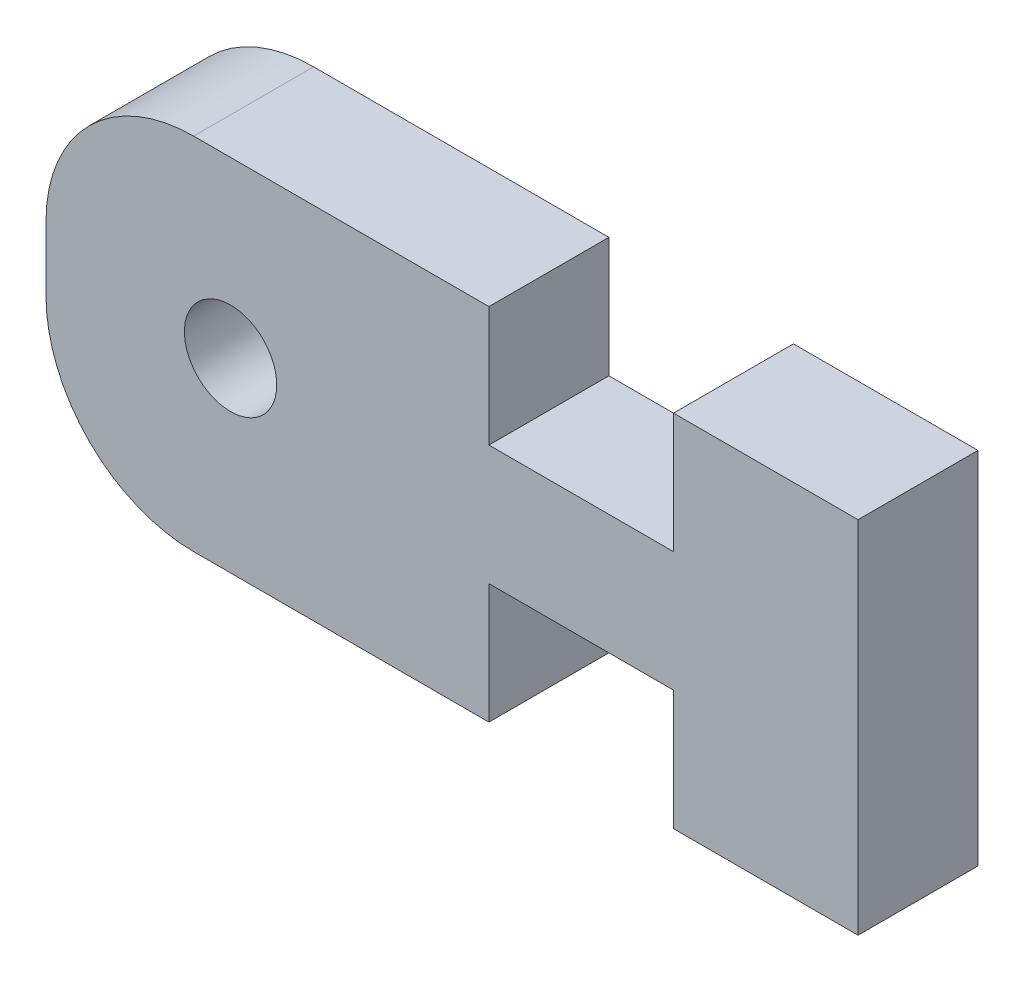
from build123d import *

# Parameters (mm, degrees)
SKETCH1_W           = 44
SKETCH1_H           = 19.5
BOSS_EXTRUDE1_DEPTH = 6.5
CUT_EXTRUDE1_REACH  = 50.564
SKETCH2_W           = 10
SKETCH2_H           = 6.5
FILLET1_R           = 8
CUT_EXTRUDE2_REACH  = 50.564
SKETCH3_R           = 2.5


with BuildPart() as part:
    # Sketch1 → Boss-Extrude1 (new body)
    with BuildSketch(Plane.XY):
        with Locations((22, 9.75)):
            Rectangle(SKETCH1_W, SKETCH1_H)
    extrude(amount=BOSS_EXTRUDE1_DEPTH)

    # Sketch2 → Cut-Extrude1 (cut, up to next)
    with BuildSketch(Plane.XY.offset(6.5), mode=Mode.PRIVATE) as cut_extrude1_sk1:
        with Locations((29, 16.25)):
            Rectangle(SKETCH2_W, SKETCH2_H)
    cut_extrude1_tool1 = extrude(cut_extrude1_sk1.sketch, amount=-CUT_EXTRUDE1_REACH, mode=Mode.PRIVATE) & part.part
    # Sketch2 → Cut-Extrude1 (cut, up to next)
    with BuildSketch(Plane.XY.offset(6.5), mode=Mode.PRIVATE) as cut_extrude1_sk2:
        with Locations((29, 3.25)):
            Rectangle(SKETCH2_W, SKETCH2_H)
    cut_extrude1_tool2 = extrude(cut_extrude1_sk2.sketch, amount=-CUT_EXTRUDE1_REACH, mode=Mode.PRIVATE) & part.part
    add(cut_extrude1_tool1.solids().sort_by_distance((29, 16.25, 6.5))[0], mode=Mode.SUBTRACT)
    add(cut_extrude1_tool2.solids().sort_by_distance((29, 3.25, 6.5))[0], mode=Mode.SUBTRACT)

    # Fillet1
    fillet1_edges = [part.edges().sort_by_distance(p)[0] for p in [
        (0, 19.5, 3.25),
        (0, 0, 3.25),
    ]]
    fillet(fillet1_edges, radius=FILLET1_R)

    # Sketch3 → Cut-Extrude2 (cut, up to next)
    with BuildSketch(Plane.XY.offset(6.5), mode=Mode.PRIVATE) as cut_extrude2_sk1:
        with Locations((10, 10.072944896)):
            Circle(SKETCH3_R)
    cut_extrude2_tool1 = extrude(cut_extrude2_sk1.sketch, amount=-CUT_EXTRUDE2_REACH, mode=Mode.PRIVATE) & part.part
    add(cut_extrude2_tool1.solids().sort_by_distance((10, 10.072945, 6.5))[0], mode=Mode.SUBTRACT)


solid = part.part
